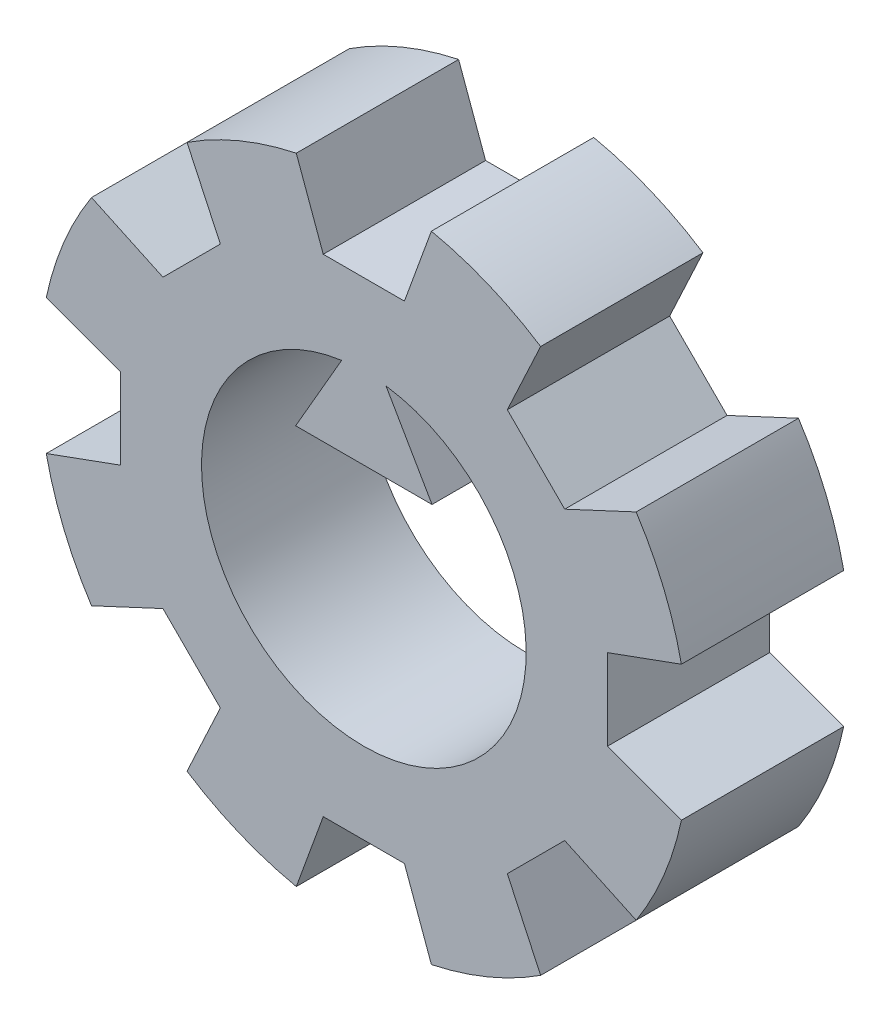
from build123d import *

# Parameters (mm, degrees)
SKETCH1_R           = 1
BOSS_EXTRUDE2_DEPTH = 0.5
CUT_EXTRUDE1_DEPTH  = 2.5
CIRPATTERN1_COUNT   = 8


with BuildPart() as part:
    # Sketch1 → Boss-Extrude2 (new body)
    with BuildSketch(Plane.XY):
        Circle(SKETCH1_R)
        with BuildLine():
            ThreePointArc((0.06837431, 0.495302891), (0, -0.5), (-0.06837431, 0.495302891))
            Line((-0.06837431, 0.495302891), (-0.21, 0.25))
            Line((-0.21, 0.25), (0, 0.25))
            Line((0, 0.25), (0.21, 0.25))
            Line((0.21, 0.25), (0.06837431, 0.495302891))
        make_face(mode=Mode.SUBTRACT)
    extrude(amount=BOSS_EXTRUDE2_DEPTH)

    # Sketch1<4> → Cut-Extrude1 (cut, symmetric)
    with BuildSketch(Plane.XY):
        with BuildLine():
            Line((-0.125, 0.75), (0.125, 0.75))
            Line((0.125, 0.75), (0.208029796, 0.978122489))
            ThreePointArc((0.208029796, 0.978122489), (0, 1), (-0.208029796, 0.978122489))
            Line((-0.208029796, 0.978122489), (-0.125, 0.75))
        make_face()
    cut_extrude1 = extrude(amount=CUT_EXTRUDE1_DEPTH, both=True, mode=Mode.SUBTRACT)

    # CirPattern1: Cut-Extrude1 ×8 about axis
    cirpattern1_axis = Axis((0, 0, 0.5), (0, 0, -1))
    for i in range(1, CIRPATTERN1_COUNT):
        add(cut_extrude1.rotate(cirpattern1_axis, i * 360 / CIRPATTERN1_COUNT), mode=Mode.SUBTRACT)


solid = part.part
